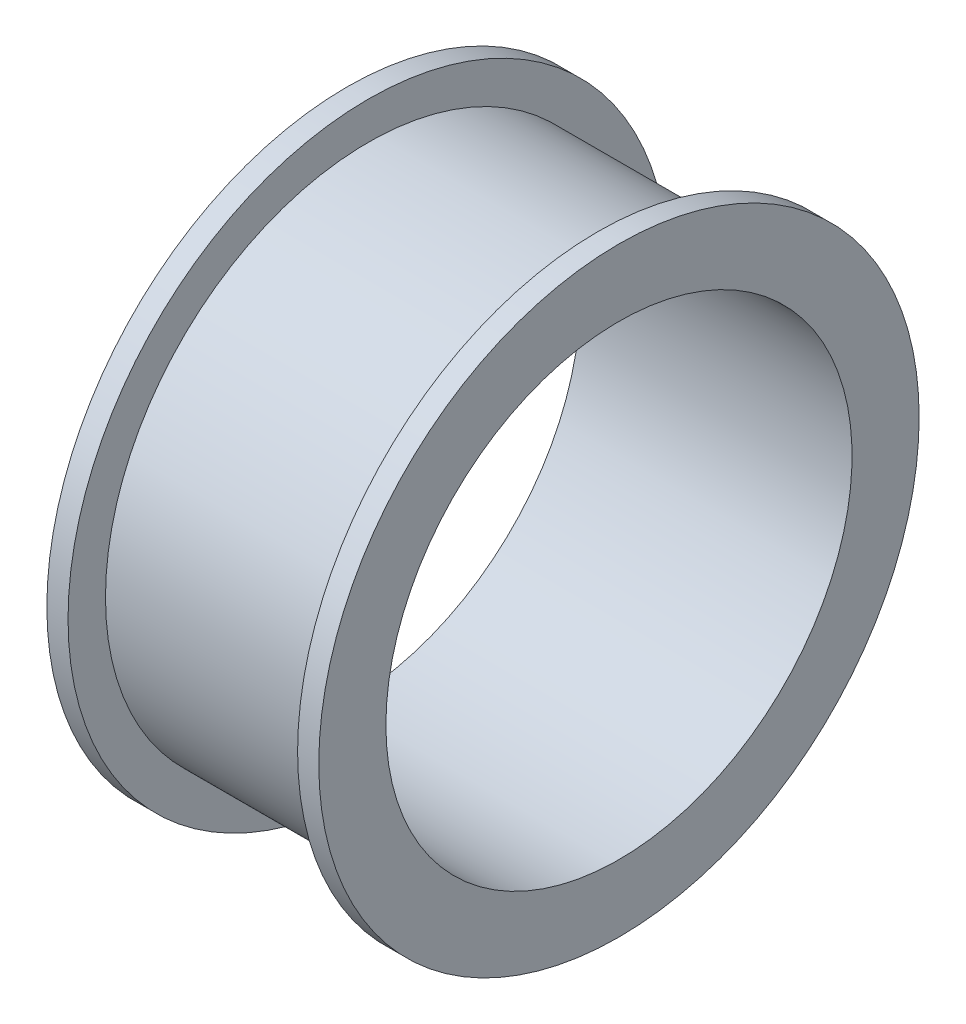
from build123d import *

# Parameters (mm, degrees)
ESBO_O1_R                = 7.44
ESBO_O1_R_2              = 6.6
RESSALTO_EXTRUS_O1_DEPTH = 3.25
ESBO_O2_R                = 8.5
RESSALTO_EXTRUS_O2_DEPTH = 0.6
ESBO_O3_R                = 6.6
CORTE_EXTRUS_O1_DEPTH    = 15.275503494


with BuildPart() as part:
    # Esboço1 → Ressalto-extrusão1 (new, symmetric)
    with BuildSketch(Plane(origin=(0, 0, 0), x_dir=(0, 0, -1), z_dir=(1, 0, 0))):
        with Locations(Location((0, 0, 0), (0, 0, 180))):
            Circle(ESBO_O1_R)
        with Locations(Location((0, 0, 0), (0, 0, 180))):
            Circle(ESBO_O1_R_2, mode=Mode.SUBTRACT)
    extrude(amount=RESSALTO_EXTRUS_O1_DEPTH, both=True)

    # Esboço2 → Ressalto-extrusão2 (add)
    with BuildSketch(Plane(origin=(3.25, 0, 0), x_dir=(0, 0, -1), z_dir=(1, 0, 0))):
        Circle(ESBO_O2_R)
    ressalto_extrus_o2 = extrude(amount=RESSALTO_EXTRUS_O2_DEPTH)

    # Espelhar1: Ressalto-extrusão2 across plane
    add(ressalto_extrus_o2.mirror(Plane(origin=(0, 0, 0), x_dir=(0, 0, 1), z_dir=(1, 0, 0))))

    # Esboço3 → Corte-extrusão1 (cut, through all)
    with BuildSketch(Plane(origin=(3.85, 0, 0), x_dir=(0, 0, -1), z_dir=(1, 0, 0))):
        with Locations(Location((0, 0, 0), (0, 0, 180))):
            Circle(ESBO_O3_R)
    extrude(amount=-CORTE_EXTRUS_O1_DEPTH, mode=Mode.SUBTRACT)


solid = part.part
